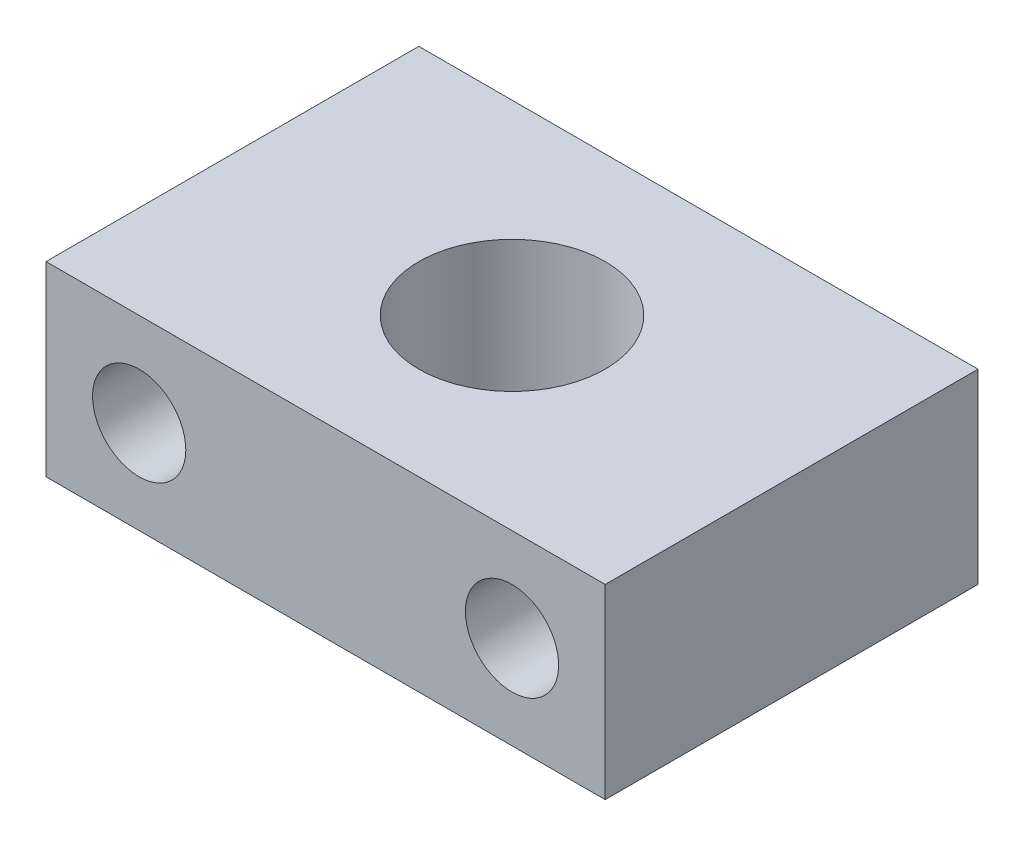
from build123d import *

# Parameters (mm, degrees)
SKETCH1_W           = 38.1
SKETCH1_H           = 25.4
BOSS_EXTRUDE1_DEPTH = 12.7
SKETCH2_R           = 6.35
CUT_EXTRUDE1_DEPTH  = 27.181720723
SKETCH3_R           = 3.175
CUT_EXTRUDE2_DEPTH  = 35.195796525


with BuildPart() as part:
    # Sketch1 → Boss-Extrude1 (new body)
    with BuildSketch(Plane(origin=(0, 0, 0), x_dir=(1, 0, 0), z_dir=(0, 1, 0))):
        Rectangle(SKETCH1_W, SKETCH1_H)
    extrude(amount=BOSS_EXTRUDE1_DEPTH)

    # Sketch2 → Cut-Extrude1 (cut, through all)
    with BuildSketch(Plane(origin=(0, 12.7, 0), x_dir=(1, 0, 0), z_dir=(0, 1, 0))):
        with Locations(Location((0, 0, 0), (0, 0, 270))):
            Circle(SKETCH2_R)
    extrude(amount=-CUT_EXTRUDE1_DEPTH, mode=Mode.SUBTRACT)

    # Sketch3 → Cut-Extrude2 (cut, through all)
    with BuildSketch(Plane(origin=(0, 0, -12.7), x_dir=(-1, 0, 0), z_dir=(0, 0, -1))):
        with Locations((-12.7, 6.35)):
            Circle(SKETCH3_R)
        with Locations(Location((12.7, 6.35, 0), (0, 0, 180))):
            Circle(SKETCH3_R)
    extrude(amount=-CUT_EXTRUDE2_DEPTH, mode=Mode.SUBTRACT)


solid = part.part
